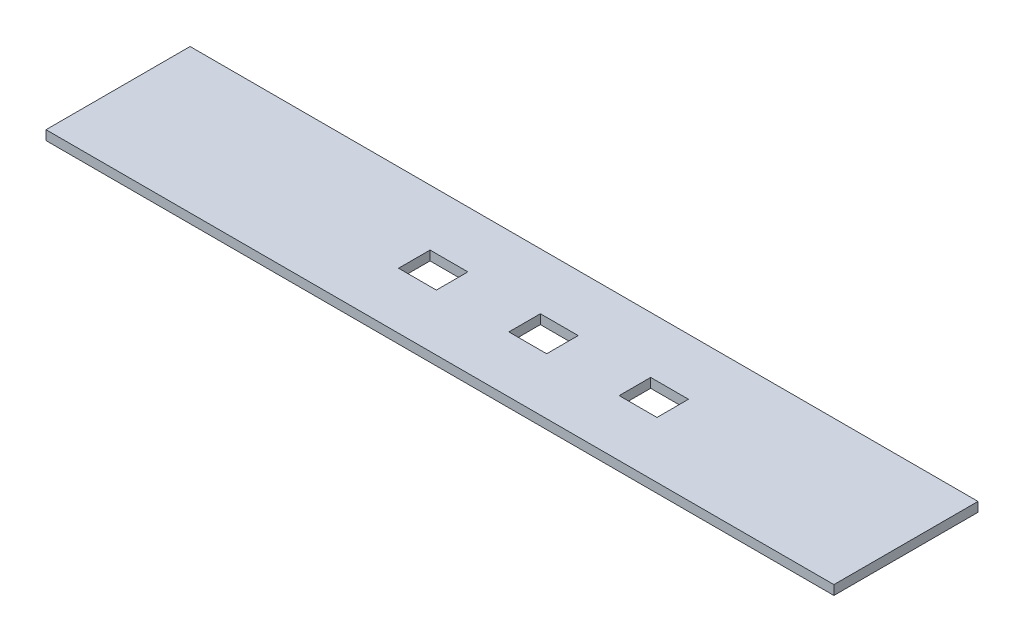
from build123d import *

# Parameters (mm, degrees)
SKETCH1_W               = 250
SKETCH1_H               = 45.72
BOSS_EXTRUDE1_DEPTH     = 3
CUT_EXTRUDE1_DEPTH      = 128.108534725
CUT_EXTRUDE1_DEPTH_BACK = 128.108534725
SKETCH2_W               = 12
SKETCH2_H               = 10


with BuildPart() as part:
    # Sketch1 → Boss-Extrude1 (new body)
    with BuildSketch(Plane(origin=(0, 0, 0), x_dir=(1, 0, 0), z_dir=(0, 1, 0))):
        Rectangle(SKETCH1_W, SKETCH1_H)
    extrude(amount=BOSS_EXTRUDE1_DEPTH)

    # Sketch2 → Cut-Extrude1 (cut, two sides: drawn at the far end of the back side and taken through both)
    with BuildSketch(Plane(origin=(0, 0, 0), x_dir=(1, 0, 0), z_dir=(0, 1, 0)).offset(-CUT_EXTRUDE1_DEPTH_BACK)):
        with Locations((-25, 0)):
            Rectangle(SKETCH2_W, SKETCH2_H)
        with Locations((10, 0)):
            Rectangle(SKETCH2_W, SKETCH2_H)
        with Locations((45, 0)):
            Rectangle(SKETCH2_W, SKETCH2_H)
    extrude(amount=CUT_EXTRUDE1_DEPTH + CUT_EXTRUDE1_DEPTH_BACK, mode=Mode.SUBTRACT)


solid = part.part
